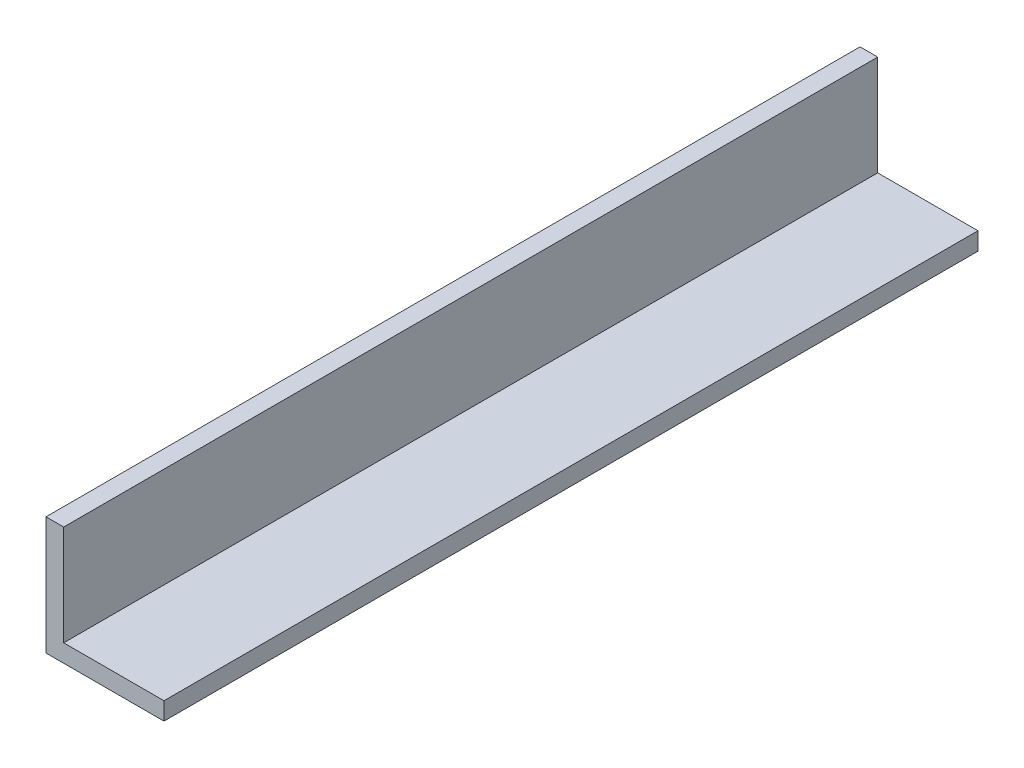
from build123d import *

# Parameters (mm, degrees)
BOSS_EXTRUDE1_DEPTH = 138


with BuildPart() as part:
    # Sketch1 → Boss-Extrude1 (new body)
    with BuildSketch(Plane.XY):
        Polygon((0, 0), (20, 0), (20, 3), (3, 3), (3, 20), (0, 20), align=None)
    extrude(amount=BOSS_EXTRUDE1_DEPTH)


solid = part.part
